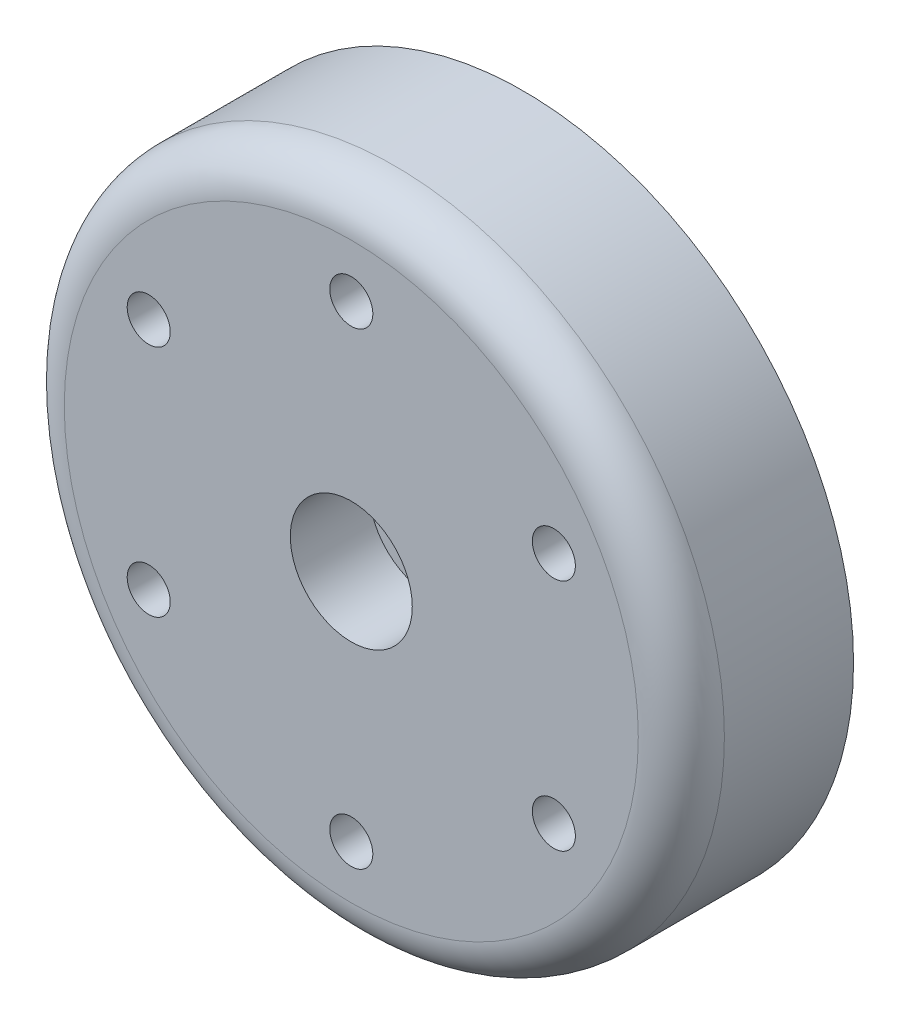
from build123d import *

# Parameters (mm, degrees)
SKETCH1_R                               = 23
SKETCH1_R_2                             = 1.5
BOSS_EXTRUDE1_DEPTH                     = 12
SKETCH2_R                               = 20
SKETCH2_R_2                             = 12.7
CUT_EXTRUDE1_DEPTH                      = 6
FILLET1_R                               = 3
CBORE_FOR_M5_HEX_HEAD_BOLT1_D           = 5
CBORE_FOR_M5_HEX_HEAD_BOLT1_CBORE_D     = 8.5
CBORE_FOR_M5_HEX_HEAD_BOLT1_CBORE_DEPTH = 5.5
SKETCH5_R                               = 8.5
CUT_EXTRUDE2_DEPTH                      = 2


with BuildPart() as part:
    # Sketch1 → Boss-Extrude1 (new body)
    with BuildSketch(Plane.XY):
        Circle(SKETCH1_R)
        with Locations((0, 16.3)):
            Circle(SKETCH1_R_2, mode=Mode.SUBTRACT)
        with Locations((14.116214082, 8.15)):
            Circle(SKETCH1_R_2, mode=Mode.SUBTRACT)
        with Locations((14.116214082, -8.15)):
            Circle(SKETCH1_R_2, mode=Mode.SUBTRACT)
        with Locations((0, -16.3)):
            Circle(SKETCH1_R_2, mode=Mode.SUBTRACT)
        with Locations((-14.116214082, -8.15)):
            Circle(SKETCH1_R_2, mode=Mode.SUBTRACT)
        with Locations((-14.116214082, 8.15)):
            Circle(SKETCH1_R_2, mode=Mode.SUBTRACT)
    extrude(amount=BOSS_EXTRUDE1_DEPTH)

    # Sketch2 → Cut-Extrude1 (cut)
    with BuildSketch(Plane(origin=(0, 0, 0), x_dir=(-1, 0, 0), z_dir=(0, 0, -1))):
        Circle(SKETCH2_R)
        Circle(SKETCH2_R_2, mode=Mode.SUBTRACT)
    extrude(amount=-CUT_EXTRUDE1_DEPTH, mode=Mode.SUBTRACT)

    # Fillet1
    fillet1_edges = [part.edges().sort_by_distance(p)[0] for p in [
        (-23, 0, 12),
    ]]
    fillet(fillet1_edges, radius=FILLET1_R)

    # CBORE for M5 Hex Head Bolt1 (through all)
    with Locations(Plane.XY.offset(12)):
        with Locations((0, 0)):
            CounterBoreHole(CBORE_FOR_M5_HEX_HEAD_BOLT1_D / 2, CBORE_FOR_M5_HEX_HEAD_BOLT1_CBORE_D / 2, CBORE_FOR_M5_HEX_HEAD_BOLT1_CBORE_DEPTH)

    # Sketch5 → Cut-Extrude2 (cut)
    with BuildSketch(Plane(origin=(0, 0, 0), x_dir=(-1, 0, 0), z_dir=(0, 0, -1))):
        Circle(SKETCH5_R)
    extrude(amount=-CUT_EXTRUDE2_DEPTH, mode=Mode.SUBTRACT)


solid = part.part
